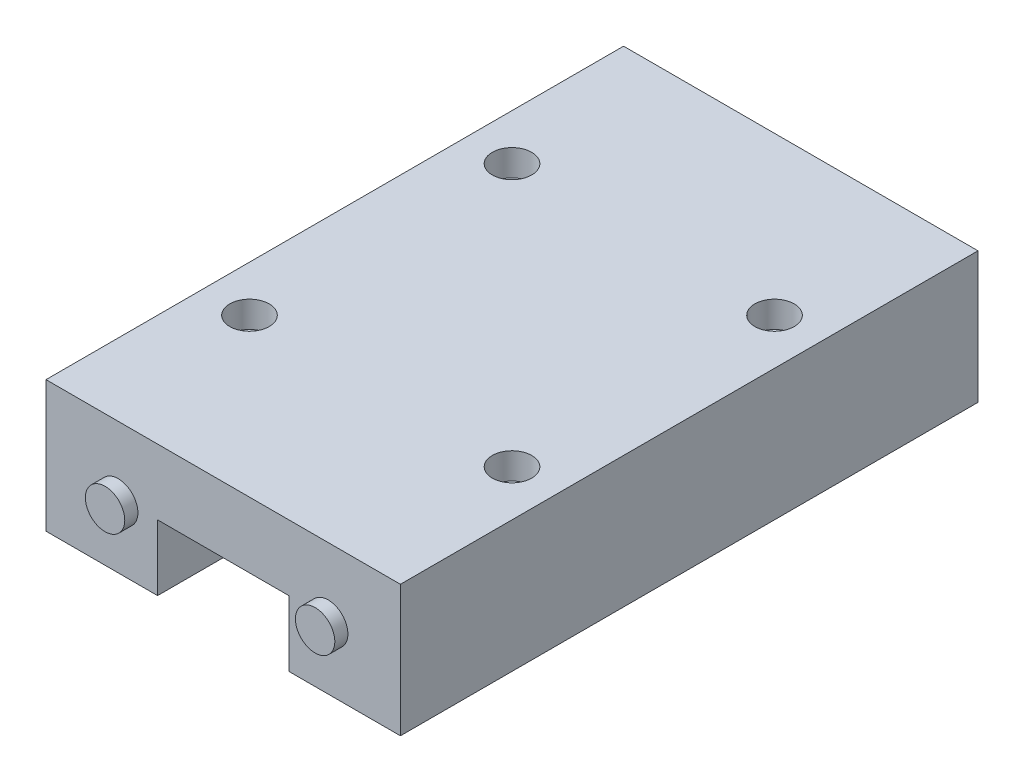
from build123d import *

# Parameters (mm, degrees)
EXTRUDE_1_DEPTH     = 44
SKETCH_2_R          = 1.5
CUT_EXTRUDE_1_DEPTH = 2
SKETCH_3_R          = 1.5
EXTRUDE_2_DEPTH     = 1
SKETCH_4_R          = 1.5
EXTRUDE_3_DEPTH     = 1


with BuildPart() as part:
    # 草圖1 → 填料-伸長1 (new body)
    with BuildSketch(Plane.XY):
        Polygon((5, -5), (13.5, -5), (13.5, 5), (-13.5, 5), (-13.5, -5), (-5, -5), (-5, 0), (5, 0), align=None)
    extrude(amount=EXTRUDE_1_DEPTH)

    # 草圖2 → 除料-伸長1 (cut)
    with BuildSketch(Plane(origin=(0, 5, 0), x_dir=(1, 0, 0), z_dir=(0, 1, 0))):
        with Locations(Location((-10, -32, 0), (0, 0, 270))):
            Circle(SKETCH_2_R)
        with Locations(Location((10, -32, 0), (0, 0, 90))):
            Circle(SKETCH_2_R)
        with Locations(Location((10, -12, 0), (0, 0, 270))):
            Circle(SKETCH_2_R)
        with Locations(Location((-10, -12, 0), (0, 0, 90))):
            Circle(SKETCH_2_R)
    extrude(amount=-CUT_EXTRUDE_1_DEPTH, mode=Mode.SUBTRACT)

    # 草圖3 → 填料-伸長2 (add)
    with BuildSketch(Plane.XY.offset(44)):
        with Locations((-8, -0.28409819)):
            Circle(SKETCH_3_R)
        with Locations(Location((8, -0.28409819, 0), (0, 0, 180))):
            Circle(SKETCH_3_R)
    extrude(amount=EXTRUDE_2_DEPTH)

    # 草圖4 → 填料-伸長3 (add)
    with BuildSketch(Plane(origin=(0, 0, 0), x_dir=(-1, 0, 0), z_dir=(0, 0, -1))):
        with Locations(Location((-8, 0, 0), (0, 0, 180))):
            Circle(SKETCH_4_R)
        with Locations(Location((8, 0, 0), (0, 0, 180))):
            Circle(SKETCH_4_R)
    extrude(amount=EXTRUDE_3_DEPTH)


solid = part.part
